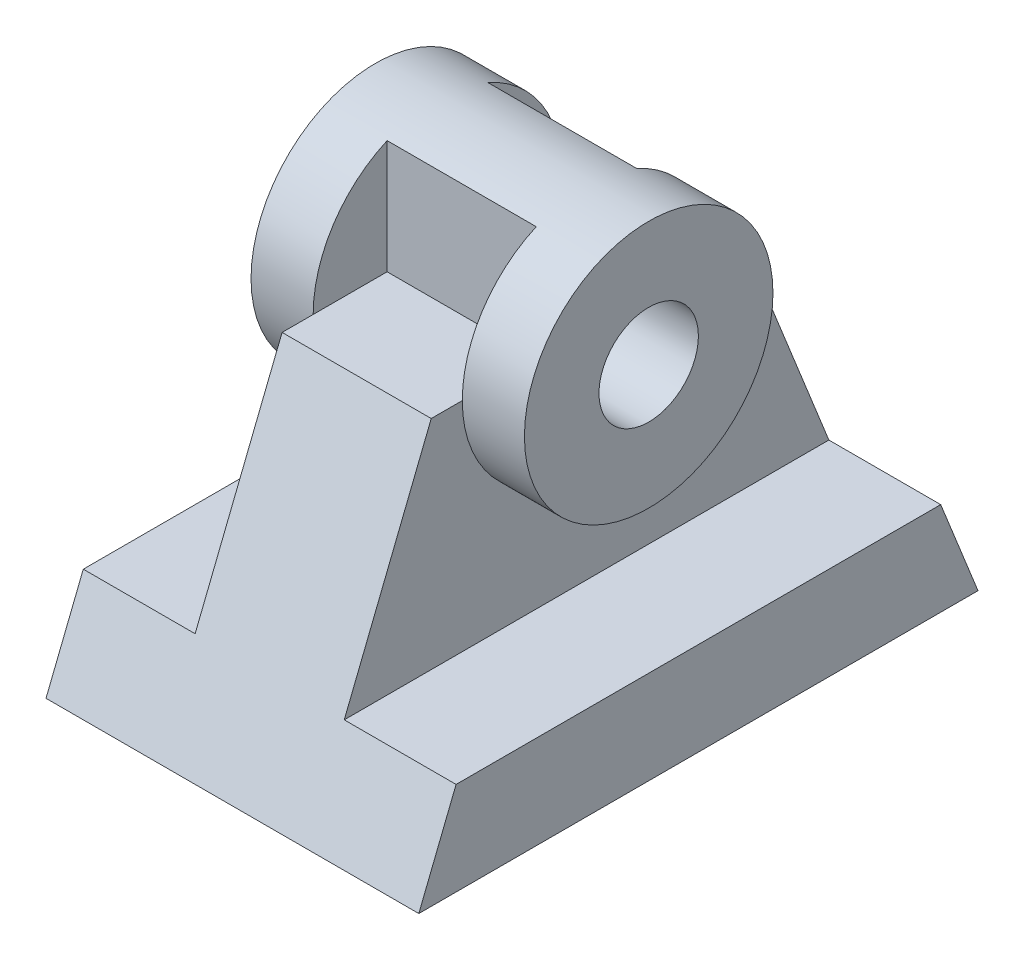
from build123d import *

# Parameters (mm, degrees)
SALIENTE_EXTRUIR1_DEPTH = 30
CROQUIS2_W              = 18
CROQUIS2_H              = 35
CORTAR_EXTRUIR1_DEPTH   = 99.107084352
CROQUIS3_R              = 20
SALIENTE_EXTRUIR3_DEPTH = 22
CROQUIS3_4_R            = 8
CORTAR_EXTRUIR2_DEPTH   = 22
CROQUIS4_W              = 24
CROQUIS4_H              = 11.9
CORTAR_EXTRUIR6_DEPTH   = 20


with BuildPart() as part:
    # Croquis1 → Saliente-Extruir1 (new, symmetric)
    with BuildSketch(Plane(origin=(0, 0, 0), x_dir=(0, 0, -1), z_dir=(1, 0, 0))):
        Polygon((45, -25), (-45, -25), (-25, 25), (25, 25), align=None)
    extrude(amount=SALIENTE_EXTRUIR1_DEPTH, both=True)

    # Croquis2 → Cortar-Extruir1 (cut, through all)
    with BuildSketch(Plane.XY.offset(45)):
        with Locations((-21, 7.5)):
            Rectangle(CROQUIS2_W, CROQUIS2_H)
        with Locations((21, 7.5)):
            Rectangle(CROQUIS2_W, CROQUIS2_H)
    extrude(amount=-CORTAR_EXTRUIR1_DEPTH, mode=Mode.SUBTRACT)

    # Croquis3 → Saliente-Extruir3 (add, symmetric)
    with BuildSketch(Plane(origin=(0, 0, 0), x_dir=(0, 0, -1), z_dir=(1, 0, 0))):
        with Locations((0, 25)):
            Circle(CROQUIS3_R)
    extrude(amount=SALIENTE_EXTRUIR3_DEPTH, both=True)

    # Croquis3<4> → Cortar-Extruir2 (cut, symmetric)
    with BuildSketch(Plane(origin=(0, 0, 0), x_dir=(0, 0, -1), z_dir=(1, 0, 0))):
        with Locations((0, 25)):
            Circle(CROQUIS3_4_R)
    extrude(amount=CORTAR_EXTRUIR2_DEPTH, both=True, mode=Mode.SUBTRACT)

    # Croquis4 → Cortar-Extruir6 (cut)
    with BuildSketch(Plane(origin=(0, 45, 0), x_dir=(1, 0, 0), z_dir=(0, 1, 0))):
        with Locations((0, 14.05)):
            Rectangle(CROQUIS4_W, CROQUIS4_H)
        with Locations((0, -14.05)):
            Rectangle(CROQUIS4_W, CROQUIS4_H)
    extrude(amount=-CORTAR_EXTRUIR6_DEPTH, mode=Mode.SUBTRACT)


solid = part.part
